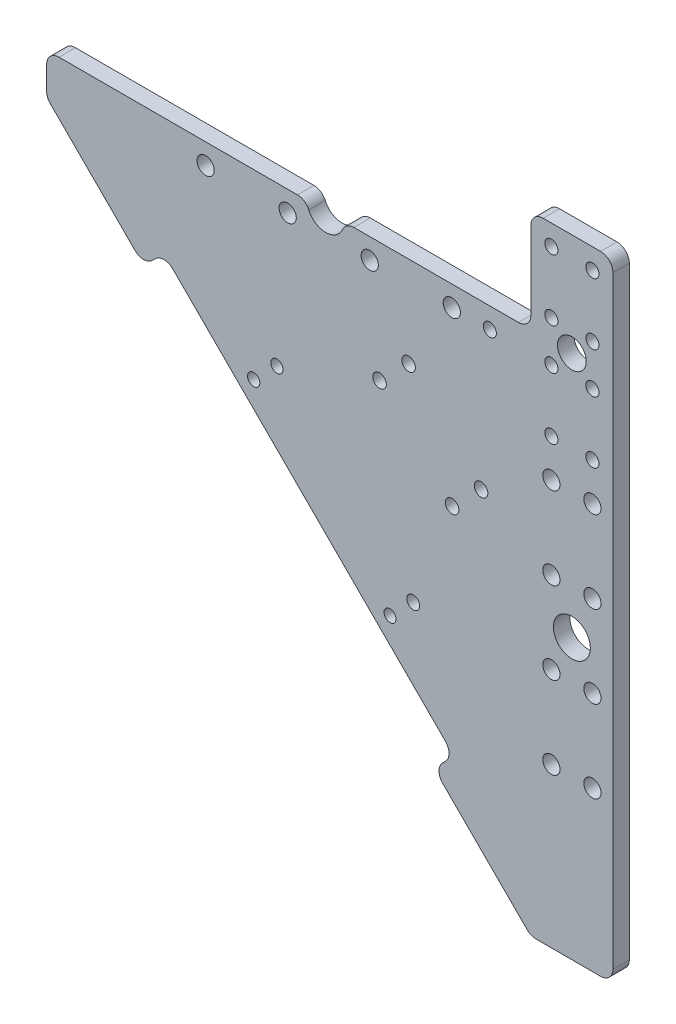
from build123d import *

# Parameters (mm, degrees)
SKETCH_1_R          = 1.462780711
SKETCH_1_R_2        = 1.582906388
SKETCH_1_R_3        = 1.5
SKETCH_1_R_4        = 1.65
EXTRUDE_1_DEPTH     = 4
SKETCH_3_R          = 3.5
SKETCH_3_R_2        = 1.6
CUT_EXTRUDE_1_DEPTH = 4
SKETCH_4_R          = 4.5
SKETCH_4_R_2        = 2.1
CUT_EXTRUDE_2_DEPTH = 4
CUT_EXTRUDE_7_DEPTH = 4
SKETCH_12_W         = 118
SKETCH_12_H         = 10
CUT_EXTRUDE_8_DEPTH = 4
SKETCH_13_W         = 20
SKETCH_13_H         = 15
SKETCH_13_R         = 1.6
EXTRUDE_4_DEPTH     = 4
FILLET_4_R          = 3


with BuildPart() as part:
    # 草图1 → 凸台-拉伸1 (new body)
    with BuildSketch(Plane.XY):
        Polygon((-128, 10), (-128, -10), (-10, -128), (10, -128), (10, 10), align=None)
        with Locations((-44.314491387, -77.548510103)):
            Circle(SKETCH_1_R, mode=Mode.SUBTRACT)
        with Locations((-38.657637138, -71.891655854)):
            Circle(SKETCH_1_R_2, mode=Mode.SUBTRACT)
        with Locations((-77.548510103, -44.314491387)):
            Circle(SKETCH_1_R_3, mode=Mode.SUBTRACT)
        with Locations((-71.891655854, -38.657637138)):
            Circle(SKETCH_1_R_3, mode=Mode.SUBTRACT)
        with Locations((-29.196699141, -46.874368671)):
            Circle(SKETCH_1_R_4, mode=Mode.SUBTRACT)
        with Locations((-46.874368671, -29.196699141)):
            Circle(SKETCH_1_R_4, mode=Mode.SUBTRACT)
        with Locations((-22.125631329, -39.803300859)):
            Circle(SKETCH_1_R_4, mode=Mode.SUBTRACT)
        with Locations((-39.803300859, -22.125631329)):
            Circle(SKETCH_1_R_4, mode=Mode.SUBTRACT)
    extrude(amount=EXTRUDE_1_DEPTH)

    # 草图3 → 切除-拉伸1 (cut)
    with BuildSketch(Plane.XY.offset(4)):
        Circle(SKETCH_3_R)
        with Locations((5, 5)):
            Circle(SKETCH_3_R_2)
        with Locations((-5, 5)):
            Circle(SKETCH_3_R_2)
        with Locations((-5, -5)):
            Circle(SKETCH_3_R_2)
        with Locations((5, -5)):
            Circle(SKETCH_3_R_2)
        with Locations((-20, -5)):
            Circle(SKETCH_3_R_2)
        with Locations((-5, -20)):
            Circle(SKETCH_3_R_2)
        with Locations((5, -20)):
            Circle(SKETCH_3_R_2)
        with Locations((5, 20)):
            Circle(SKETCH_3_R_2)
        with Locations((-5, 20)):
            Circle(SKETCH_3_R_2)
        with Locations((20, -5)):
            Circle(SKETCH_3_R_2)
        with Locations((20, 5)):
            Circle(SKETCH_3_R_2)
        with Locations((-20, 5)):
            Circle(SKETCH_3_R_2)
    extrude(amount=-CUT_EXTRUDE_1_DEPTH, mode=Mode.SUBTRACT)

    # 草图4 → 切除-拉伸2 (cut)
    with BuildSketch(Plane.XY.offset(4)):
        with Locations((0, -60)):
            Circle(SKETCH_4_R)
        with Locations((-5, -29.263884189)):
            Circle(SKETCH_4_R_2)
        with Locations((5, -29.263884189)):
            Circle(SKETCH_4_R_2)
        with Locations((5, -49.263884189)):
            Circle(SKETCH_4_R_2)
        with Locations((5, -69.263884189)):
            Circle(SKETCH_4_R_2)
        with Locations((5, -89.263884189)):
            Circle(SKETCH_4_R_2)
        with Locations((-5, -49.263884189)):
            Circle(SKETCH_4_R_2)
        with Locations((-5, -69.263884189)):
            Circle(SKETCH_4_R_2)
        with Locations((-5, -89.263884189)):
            Circle(SKETCH_4_R_2)
        with Locations(Location((-89.263884189, -5, 0), (0, 0, 180))):
            Circle(SKETCH_4_R_2)
        with Locations(Location((-69.263884189, -5, 0), (0, 0, 180))):
            Circle(SKETCH_4_R_2)
        with Locations(Location((-49.263884189, -5, 0), (0, 0, 180))):
            Circle(SKETCH_4_R_2)
        with Locations(Location((-89.263884189, 5, 0), (0, 0, 180))):
            Circle(SKETCH_4_R_2)
        with Locations(Location((-69.263884189, 5, 0), (0, 0, 180))):
            Circle(SKETCH_4_R_2)
        with Locations(Location((-49.263884189, 5, 0), (0, 0, 180))):
            Circle(SKETCH_4_R_2)
        with Locations(Location((-29.263884189, 5, 0), (0, 0, 180))):
            Circle(SKETCH_4_R_2)
        with Locations(Location((-29.263884189, -5, 0), (0, 0, 180))):
            Circle(SKETCH_4_R_2)
        with Locations(Location((-60, 0, 0), (0, 0, 180))):
            Circle(SKETCH_4_R)
    extrude(amount=-CUT_EXTRUDE_2_DEPTH, mode=Mode.SUBTRACT)

    # 草图11 → 切除-拉伸7 (cut)
    with BuildSketch(Plane.XY.offset(4)):
        Polygon((-69, -69), (-64.050252532, -64.050252532), (-99.405591591, -28.694913472), (-104.355339059, -33.644660941), align=None)
        Polygon((-28.694913472, -99.405591591), (-64.050252532, -64.050252532), (-69, -69), (-33.644660941, -104.355339059), align=None)
    extrude(amount=-CUT_EXTRUDE_7_DEPTH, mode=Mode.SUBTRACT)

    # 草图12 → 切除-拉伸8 (cut)
    with BuildSketch(Plane.XY.offset(4)):
        with Locations((-69, 5)):
            Rectangle(SKETCH_12_W, SKETCH_12_H)
    extrude(amount=-CUT_EXTRUDE_8_DEPTH, mode=Mode.SUBTRACT)

    # 草图13 → 凸台-拉伸4 (add)
    with BuildSketch(Plane.XY.offset(4)):
        with Locations((0, 17.5)):
            Rectangle(SKETCH_13_W, SKETCH_13_H)
        with Locations((-5, 20)):
            Circle(SKETCH_13_R, mode=Mode.SUBTRACT)
        with Locations((5, 20)):
            Circle(SKETCH_13_R, mode=Mode.SUBTRACT)
    extrude(amount=-EXTRUDE_4_DEPTH)

    # 圆角4
    fillet_4_edges = [part.edges().sort_by_distance(p)[0] for p in [
        (-99.405591591, -28.694913472, 2),
        (-28.694913472, -99.405591591, 2),
        (-33.644660941, -104.355339059, 2),
        (-104.355339059, -33.644660941, 2),
        (-64.5, 0, 2),
        (-55.5, 0, 2),
        (-10, 0, 2),
        (-128, 0, 2),
        (10, -128, 2),
        (-10, -128, 2),
        (-128, -10, 2),
        (10, 25, 2),
        (-10, 25, 2),
    ]]
    fillet(fillet_4_edges, radius=FILLET_4_R)


solid = part.part
